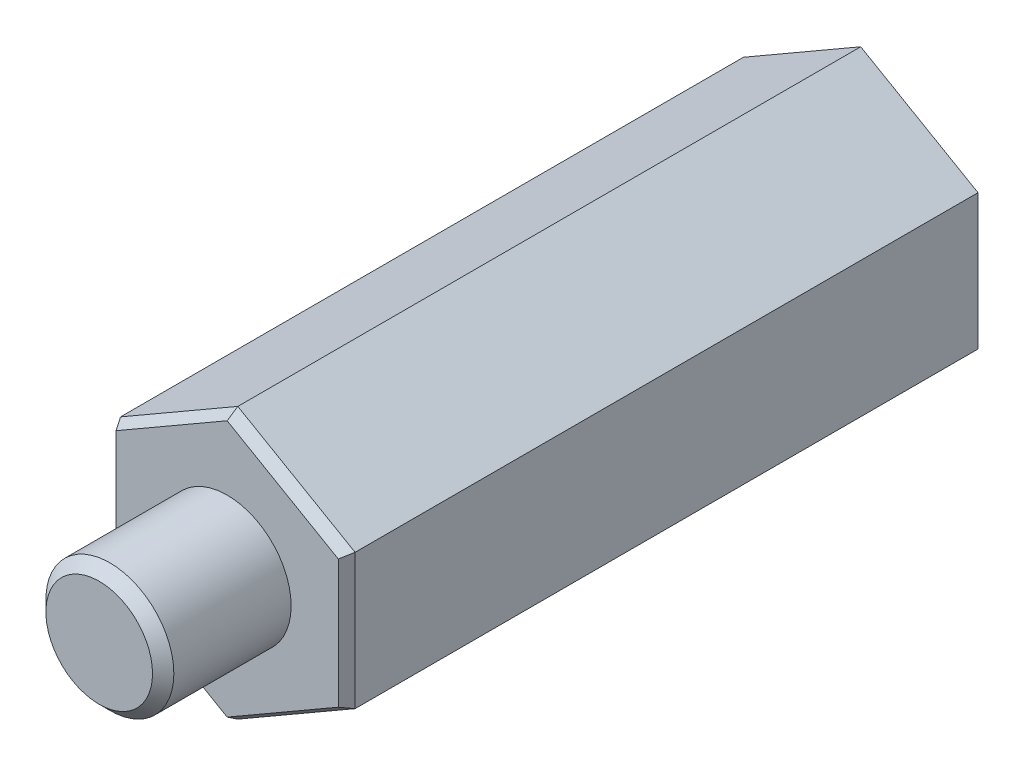
from build123d import *
from OCP.BRepFilletAPI import BRepFilletAPI_MakeChamfer

# Parameters (mm, degrees)
EXTRUDE_1_DEPTH      = 15
M3X0_5_1_D           = 2.5
M3X0_5_1_DEPTH       = 8
M3X0_5_1_CSINK_D     = 3.05
M3X0_5_1_CSINK_ANGLE = 90
M3X0_5_1_TIP         = 0.751075774
SKETCH_4_R           = 1.5
EXTRUDE_2_DEPTH      = 3
CHAMFER_1_SIZE       = 0.25
CHAMFER_2_SIZE       = 0.25
CHAMFER_2_SIZE2      = 0.144337567


with BuildPart() as part:
    # ｽｹｯﾁ1 → ﾎﾞｽ - 押し出し1 (new body)
    with BuildSketch(Plane.XY):
        Polygon((-2.75, 1.58771324), (-2.75, -1.58771324), (0, -3.175426481), (2.75, -1.58771324), (2.75, 1.58771324), (0, 3.175426481), align=None)
    extrude(amount=-EXTRUDE_1_DEPTH)

    # M3x0.5 ねじ穴1
    with Locations(Plane(origin=(0, 0, -15), x_dir=(-1, 0, 0), z_dir=(0, 0, -1))):
        with Locations((0, 0)):
            CounterSinkHole(M3X0_5_1_D / 2, M3X0_5_1_CSINK_D / 2, depth=M3X0_5_1_DEPTH, counter_sink_angle=M3X0_5_1_CSINK_ANGLE)
            with Locations((0, 0, -(M3X0_5_1_DEPTH + M3X0_5_1_TIP / 2))):  # 118° drill point
                Cone(0, M3X0_5_1_D / 2, M3X0_5_1_TIP, mode=Mode.SUBTRACT)

    # ｽｹｯﾁ4 → ﾎﾞｽ - 押し出し2 (add)
    with BuildSketch(Plane.XY):
        Circle(SKETCH_4_R)
    extrude(amount=EXTRUDE_2_DEPTH)

    # 面取り1
    chamfer_1_edges = [part.edges().sort_by_distance(p)[0] for p in [
        (-1.5, 0, 3),
    ]]
    chamfer(chamfer_1_edges, length=CHAMFER_1_SIZE)

    # 面取り2: one chamfer whose edges measure the first distance from different faces: ONE call of the kernel's chamfer builder (chamfer() names one face for all edges)
    chamfer_2_edges_1 = [part.edges().sort_by_distance(p)[0] for p in [
        (-1.375, -2.38156986, -15),
        (1.375, -2.38156986, -15),
        (2.75, 0, -15),
        (1.375, 2.38156986, -15),
        (-1.375, 2.38156986, -15),
        (-2.75, 0, -15),
    ]]
    chamfer_2_side_1 = [part.faces().sort_by_distance(p)[0] for p in [
        (-2.665986112, 0, -15),
    ]]
    chamfer_2_edges_2 = [part.edges().sort_by_distance(p)[0] for p in [
        (1.375, 2.38156986, 0),
    ]]
    chamfer_2_side_2 = [part.faces().sort_by_distance(p)[0] for p in [
        (1.375, 2.38156986, -7.5),
    ]]
    chamfer_2_edges_3 = [part.edges().sort_by_distance(p)[0] for p in [
        (2.75, 0, 0),
    ]]
    chamfer_2_side_3 = [part.faces().sort_by_distance(p)[0] for p in [
        (2.75, 0, -7.5),
    ]]
    chamfer_2_edges_4 = [part.edges().sort_by_distance(p)[0] for p in [
        (1.375, -2.38156986, 0),
    ]]
    chamfer_2_side_4 = [part.faces().sort_by_distance(p)[0] for p in [
        (1.375, -2.38156986, -7.5),
    ]]
    chamfer_2_edges_5 = [part.edges().sort_by_distance(p)[0] for p in [
        (-1.375, -2.38156986, 0),
    ]]
    chamfer_2_side_5 = [part.faces().sort_by_distance(p)[0] for p in [
        (-1.375, -2.38156986, -7.5),
    ]]
    chamfer_2_edges_6 = [part.edges().sort_by_distance(p)[0] for p in [
        (-2.75, 0, 0),
    ]]
    chamfer_2_side_6 = [part.faces().sort_by_distance(p)[0] for p in [
        (-2.75, 0, -7.5),
    ]]
    chamfer_2_edges_7 = [part.edges().sort_by_distance(p)[0] for p in [
        (-1.375, 2.38156986, 0),
    ]]
    chamfer_2_side_7 = [part.faces().sort_by_distance(p)[0] for p in [
        (-1.375, 2.38156986, -7.5),
    ]]
    chamfer_2 = BRepFilletAPI_MakeChamfer(part.part.solid().wrapped)
    for e in chamfer_2_edges_1:
        chamfer_2.Add(CHAMFER_2_SIZE, CHAMFER_2_SIZE2, e.wrapped, chamfer_2_side_1[0].wrapped)  # the first distance lies on this face
    for e in chamfer_2_edges_2:
        chamfer_2.Add(CHAMFER_2_SIZE, CHAMFER_2_SIZE2, e.wrapped, chamfer_2_side_2[0].wrapped)  # the first distance lies on this face
    for e in chamfer_2_edges_3:
        chamfer_2.Add(CHAMFER_2_SIZE, CHAMFER_2_SIZE2, e.wrapped, chamfer_2_side_3[0].wrapped)  # the first distance lies on this face
    for e in chamfer_2_edges_4:
        chamfer_2.Add(CHAMFER_2_SIZE, CHAMFER_2_SIZE2, e.wrapped, chamfer_2_side_4[0].wrapped)  # the first distance lies on this face
    for e in chamfer_2_edges_5:
        chamfer_2.Add(CHAMFER_2_SIZE, CHAMFER_2_SIZE2, e.wrapped, chamfer_2_side_5[0].wrapped)  # the first distance lies on this face
    for e in chamfer_2_edges_6:
        chamfer_2.Add(CHAMFER_2_SIZE, CHAMFER_2_SIZE2, e.wrapped, chamfer_2_side_6[0].wrapped)  # the first distance lies on this face
    for e in chamfer_2_edges_7:
        chamfer_2.Add(CHAMFER_2_SIZE, CHAMFER_2_SIZE2, e.wrapped, chamfer_2_side_7[0].wrapped)  # the first distance lies on this face
    add(Compound.cast(chamfer_2.Shape()), mode=Mode.REPLACE)


solid = part.part
